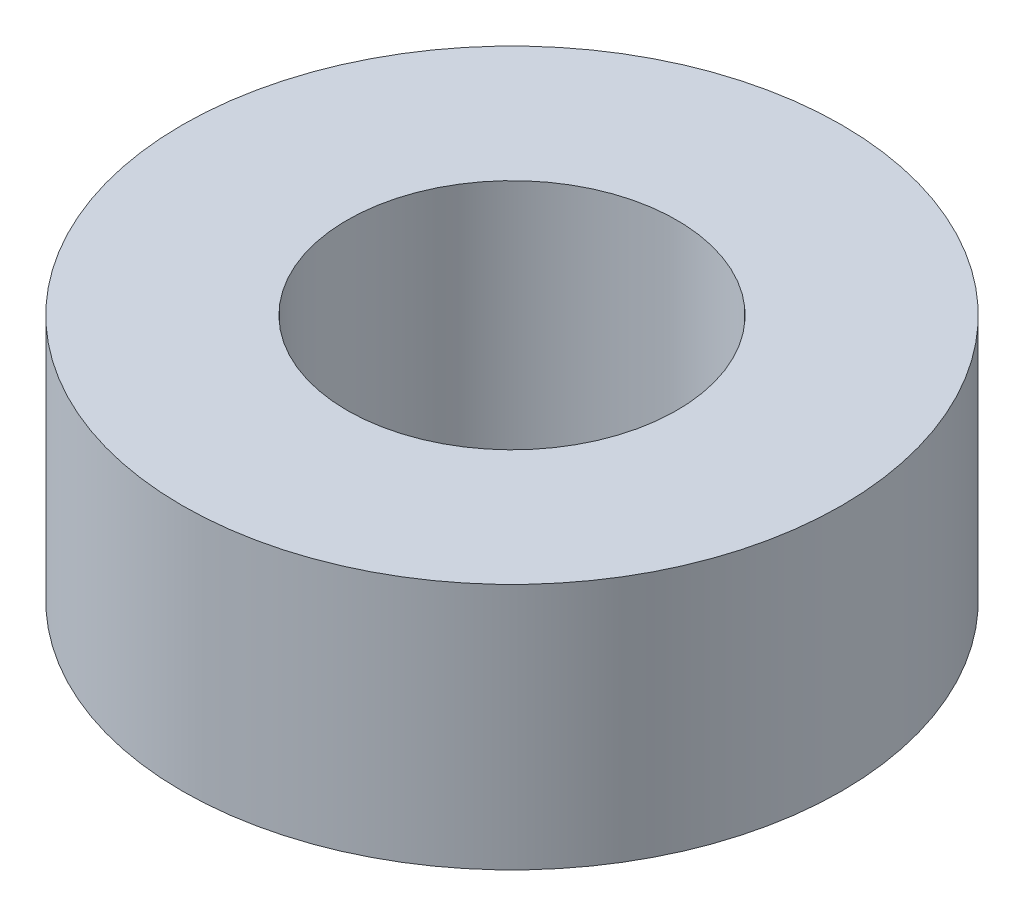
from build123d import *

# Parameters (mm, degrees)
BOSS_EXTRUDE1_DEPTH      = 1.5
BOSS_EXTRUDE1_DEPTH_BACK = 1.5
SKETCH1_R                = 4
SKETCH1_R_2              = 2


with BuildPart() as part:
    # Sketch1 → Boss-Extrude1 (new, two sides: drawn at the far end of the back side and taken through both)
    with BuildSketch(Plane(origin=(0, 0, 0), x_dir=(1, 0, 0), z_dir=(0, 1, 0)).offset(-BOSS_EXTRUDE1_DEPTH_BACK)):
        Circle(SKETCH1_R)
        Circle(SKETCH1_R_2, mode=Mode.SUBTRACT)
    extrude(amount=BOSS_EXTRUDE1_DEPTH + BOSS_EXTRUDE1_DEPTH_BACK)


solid = part.part
